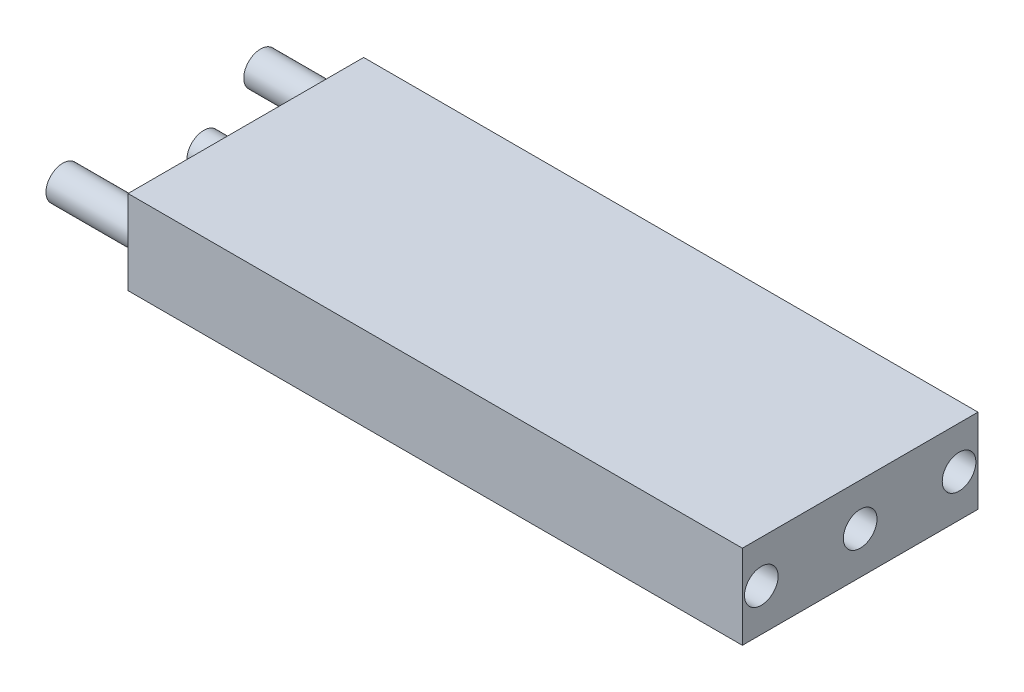
from build123d import *

# Parameters (mm, degrees)
SKETCH2_W           = 73
SKETCH2_H           = 28
BOSS_EXTRUDE1_DEPTH = 5
CUT_EXTRUDE2_START  = 36.5
SKETCH3_R           = 2
CUT_EXTRUDE2_DEPTH  = 5
BOSS_EXTRUDE2_START = -36.5
SKETCH3_2_R         = 2
BOSS_EXTRUDE2_DEPTH = 10
BOSS_EXTRUDE3_START = -36.5
SKETCH3_3_R         = 2
BOSS_EXTRUDE3_DEPTH = 5


with BuildPart() as part:
    # Sketch2 → Boss-Extrude1 (new, symmetric)
    with BuildSketch(Plane(origin=(0, 0, 0), x_dir=(1, 0, 0), z_dir=(0, 1, 0))):
        Rectangle(SKETCH2_W, SKETCH2_H)
    extrude(amount=BOSS_EXTRUDE1_DEPTH, both=True)

    # Sketch3 → Cut-Extrude2 (cut)
    with BuildSketch(Plane(origin=(0, 0, 0), x_dir=(0, 0, -1), z_dir=(1, 0, 0)).offset(CUT_EXTRUDE2_START)):
        with Locations(Location((0, 0, 0), (0, 0, 180))):
            Circle(SKETCH3_R)
        with Locations(Location((11.75, 0, 0), (0, 0, 180))):
            Circle(SKETCH3_R)
        with Locations(Location((-11.75, 0, 0), (0, 0, 180))):
            Circle(SKETCH3_R)
    extrude(amount=-CUT_EXTRUDE2_DEPTH, mode=Mode.SUBTRACT)

    # Sketch3<2> → Boss-Extrude2 (add, symmetric)
    with BuildSketch(Plane(origin=(0, 0, 0), x_dir=(0, 0, -1), z_dir=(1, 0, 0)).offset(BOSS_EXTRUDE2_START)):
        with Locations(Location((11.75, 0, 0), (0, 0, 180))):
            Circle(SKETCH3_2_R)
        with Locations(Location((-11.75, 0, 0), (0, 0, 180))):
            Circle(SKETCH3_2_R)
    extrude(amount=BOSS_EXTRUDE2_DEPTH, both=True)

    # Sketch3<3> → Boss-Extrude3 (add, symmetric)
    with BuildSketch(Plane(origin=(0, 0, 0), x_dir=(0, 0, -1), z_dir=(1, 0, 0)).offset(BOSS_EXTRUDE3_START)):
        with Locations(Location((0, 0, 0), (0, 0, 180))):
            Circle(SKETCH3_3_R)
    extrude(amount=BOSS_EXTRUDE3_DEPTH, both=True)


solid = part.part
